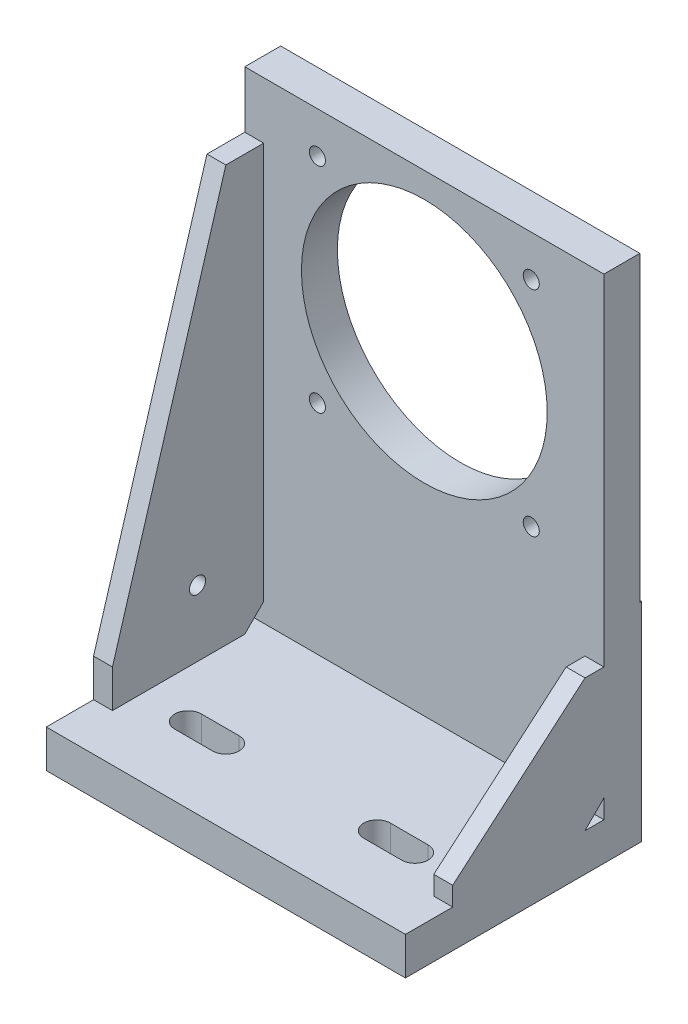
from build123d import *

# Parameters (mm, degrees)
SKETCH1_W                  = 190
SKETCH1_H                  = 125
BOSS_EXTRUDE1_DEPTH        = 20
SKETCH2_W                  = 190
SKETCH2_H                  = 250
BOSS_EXTRUDE2_DEPTH        = 20
SKETCH3_W                  = 80
SKETCH3_H                  = 220
BOSS_EXTRUDE3_DEPTH        = 10
SKETCH4_W                  = 80
SKETCH4_H                  = 70
BOSS_EXTRUDE4_DEPTH        = 10
CUT_EXTRUDE1_DEPTH         = 354.022662162
CUT_EXTRUDE2_DEPTH         = 10
CUT_EXTRUDE3_DEPTH         = 10
SKETCH8_W                  = 190
SKETCH8_H                  = 160
CUT_EXTRUDE4_DEPTH         = 1
SKETCH9_R                  = 65
CUT_EXTRUDE5_DEPTH         = 353.669817251
CUT_EXTRUDE6_DEPTH         = 338.971892322
M10X1_5_TAPPED_HOLE1_D     = 8.5
M10X1_5_TAPPED_HOLE2_D     = 8.5
M10X1_5_TAPPED_HOLE2_DEPTH = 10


with BuildPart() as part:
    # Sketch1 → Boss-Extrude1 (new body)
    with BuildSketch(Plane(origin=(0, 0, 0), x_dir=(1, 0, 0), z_dir=(0, 1, 0))):
        with Locations((95, -62.5)):
            Rectangle(SKETCH1_W, SKETCH1_H)
    extrude(amount=BOSS_EXTRUDE1_DEPTH)

    # Sketch2 → Boss-Extrude2 (add)
    with BuildSketch(Plane(origin=(0, 0, 0), x_dir=(-1, 0, 0), z_dir=(0, 0, -1))):
        with Locations((-95, 145)):
            Rectangle(SKETCH2_W, SKETCH2_H)
    extrude(amount=-BOSS_EXTRUDE2_DEPTH)

    # Sketch3 → Boss-Extrude3 (add)
    with BuildSketch(Plane.ZY):
        with Locations((60, 130)):
            Rectangle(SKETCH3_W, SKETCH3_H)
    extrude(amount=-BOSS_EXTRUDE3_DEPTH)

    # Sketch4 → Boss-Extrude4 (add)
    with BuildSketch(Plane(origin=(190, 0, 0), x_dir=(0, 0, -1), z_dir=(1, 0, 0))):
        with Locations((-60, 55)):
            Rectangle(SKETCH4_W, SKETCH4_H)
    extrude(amount=-BOSS_EXTRUDE4_DEPTH)

    # Sketch5 → Cut-Extrude1 (cut, through all)
    with BuildSketch(Plane.ZY):
        Polygon((20, 30), (20, 20), (30, 20), align=None)
    extrude(amount=-CUT_EXTRUDE1_DEPTH, mode=Mode.SUBTRACT)

    # Sketch6 → Cut-Extrude2 (cut)
    with BuildSketch(Plane.ZY):
        Polygon((40, 240), (100, 40), (100, 240), align=None)
    extrude(amount=-CUT_EXTRUDE2_DEPTH, mode=Mode.SUBTRACT)

    # Sketch7 → Cut-Extrude3 (cut)
    with BuildSketch(Plane(origin=(190, 0, 0), x_dir=(0, 0, -1), z_dir=(1, 0, 0))):
        Polygon((-100, 90), (-30, 90), (-100, 30), align=None)
    extrude(amount=-CUT_EXTRUDE3_DEPTH, mode=Mode.SUBTRACT)

    # Sketch8 → Cut-Extrude4 (cut)
    with BuildSketch(Plane(origin=(0, 0, 0), x_dir=(-1, 0, 0), z_dir=(0, 0, -1))):
        with Locations((-95, 190)):
            Rectangle(SKETCH8_W, SKETCH8_H)
    extrude(amount=-CUT_EXTRUDE4_DEPTH, mode=Mode.SUBTRACT)

    # Sketch9 → Cut-Extrude5 (cut, through all)
    with BuildSketch(Plane(origin=(0, 0, 1), x_dir=(-1, 0, 0), z_dir=(0, 0, -1))):
        with Locations((-95, 191.7)):
            Circle(SKETCH9_R)
    extrude(amount=-CUT_EXTRUDE5_DEPTH, mode=Mode.SUBTRACT)

    # Sketch10 → Cut-Extrude6 (cut, through all)
    with BuildSketch(Plane(origin=(0, 20, 0), x_dir=(1, 0, 0), z_dir=(0, 1, 0))):
        with BuildLine():
            Line((35, -78), (55, -78))
            ThreePointArc((55, -78), (62, -85), (55, -92))
            Line((55, -92), (35, -92))
            ThreePointArc((35, -92), (28, -85), (35, -78))
        make_face()
        with BuildLine():
            Line((135, -78), (155, -78))
            ThreePointArc((155, -78), (162, -85), (155, -92))
            Line((155, -92), (135, -92))
            ThreePointArc((135, -92), (128, -85), (135, -78))
        make_face()
    extrude(amount=-CUT_EXTRUDE6_DEPTH, mode=Mode.SUBTRACT)

    # M10x1.5 Tapped Hole1 (through all)
    with Locations(Plane(origin=(0, 0, 1), x_dir=(-1, 0, 0), z_dir=(0, 0, -1))):
        with Locations((-38.431457505, 248.268542495), (-151.568542495, 248.268542495), (-151.568542495, 135.131457505), (-38.431457505, 135.131457505)):
            Hole(M10X1_5_TAPPED_HOLE1_D / 2)

    # M10x1.5 Tapped Hole2
    with Locations(Plane.ZY):
        with Locations((55, 55)):
            Hole(M10X1_5_TAPPED_HOLE2_D / 2, depth=M10X1_5_TAPPED_HOLE2_DEPTH)


solid = part.part
